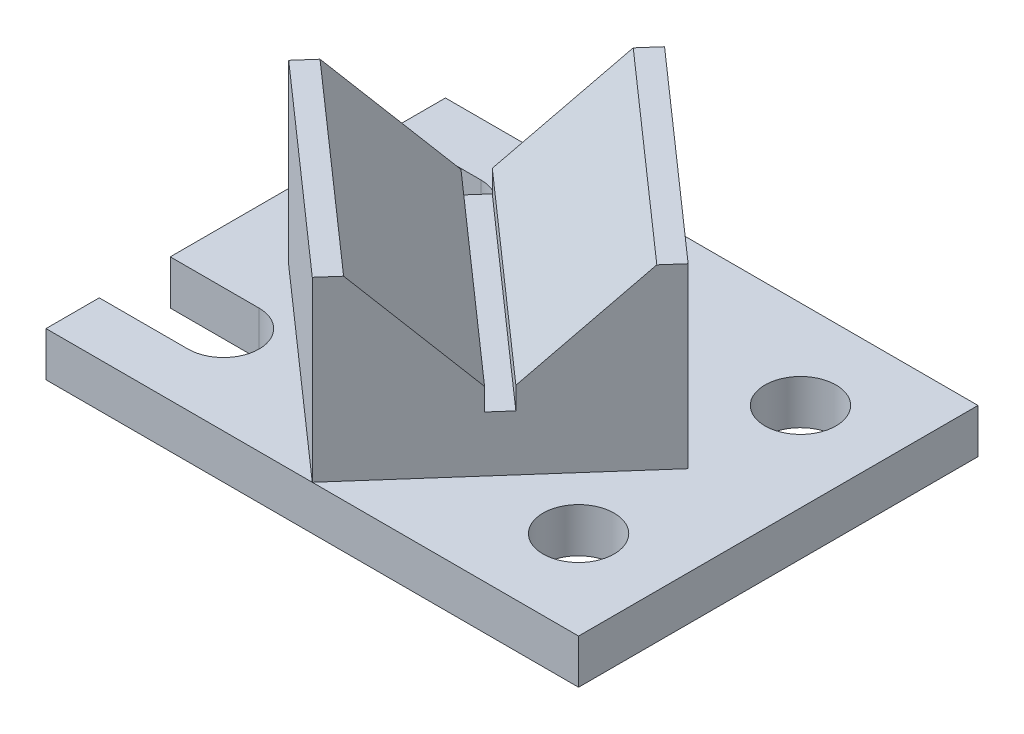
from build123d import *

# Parameters (mm, degrees)
SKETCH3_R               = 10.16
BOSS_EXTRUDE2_DEPTH     = 12.7
BOSS_EXTRUDE3_DEPTH     = 50.8
CUT_EXTRUDE1_DEPTH      = 195.200593167
CUT_EXTRUDE1_DEPTH_BACK = 195.200593167


with BuildPart() as part:
    # Sketch3 → Boss-Extrude2 (new body)
    # profile 1 of 2: a face of its own
    with BuildSketch(Plane(origin=(0, 0, 0), x_dir=(1, 0, 0), z_dir=(0, 1, 0))):
        with BuildLine():
            Line((0, 57.15), (0, 35.56))
            Line((0, 35.56), (25.4, 35.56))
            ThreePointArc((25.4, 35.56), (35.56, 25.4), (25.4, 15.24))
            Line((25.4, 15.24), (0, 15.24))
            Line((0, 15.24), (0, 0))
            Line((0, 0), (152.4, 0))
            Line((152.4, 0), (152.4, 57.15))
            Line((152.4, 57.15), (0, 57.15))
        make_face()
        with Locations(Location((127, 25.4, 0), (0, 0, 270))):
            Circle(SKETCH3_R, mode=Mode.SUBTRACT)
    # profile 2 of 2: a face of its own
    with BuildSketch(Plane(origin=(0, 0, 0), x_dir=(1, 0, 0), z_dir=(0, 1, 0))):
        with BuildLine():
            Line((0, 78.74), (0, 57.15))
            Line((0, 57.15), (152.4, 57.15))
            Line((152.4, 57.15), (152.4, 114.3))
            Line((152.4, 114.3), (0, 114.3))
            Line((0, 114.3), (0, 99.06))
            Line((0, 99.06), (25.4, 99.06))
            ThreePointArc((25.4, 99.06), (35.56, 88.9), (25.4, 78.74))
            Line((25.4, 78.74), (0, 78.74))
        make_face()
        with Locations(Location((127, 88.9, 0), (0, 0, 270))):
            Circle(SKETCH3_R, mode=Mode.SUBTRACT)
    extrude(amount=-BOSS_EXTRUDE2_DEPTH)

    # Sketch4 → Boss-Extrude3 (add)
    with BuildSketch(Plane(origin=(0, 0, 0), x_dir=(1, 0, 0), z_dir=(0, 1, 0))):
        Polygon((76.2, 0), (19.05, 50.401562476), (69.451562476, 107.551562476), (126.601562476, 57.15), align=None)
    extrude(amount=BOSS_EXTRUDE3_DEPTH)

    # Sketch5 → Cut-Extrude1 (cut, two sides: drawn at the far end of the back side and taken through both)
    with BuildSketch(Plane(origin=(42.8625, 0, 37.801171857), x_dir=(0.661437827766148, 0, -0.7499999999999998), z_dir=(0.7499999999999998, 0, 0.661437827766148)).offset(-CUT_EXTRUDE1_DEPTH_BACK)):
        Polygon((56.751562476, 50.8), (85.326562476, 22.225), (85.326562476, 15.875), (91.676562476, 15.875), (91.676562476, 22.225), (120.251562476, 50.8), align=None)
    extrude(amount=CUT_EXTRUDE1_DEPTH + CUT_EXTRUDE1_DEPTH_BACK, mode=Mode.SUBTRACT)


solid = part.part
